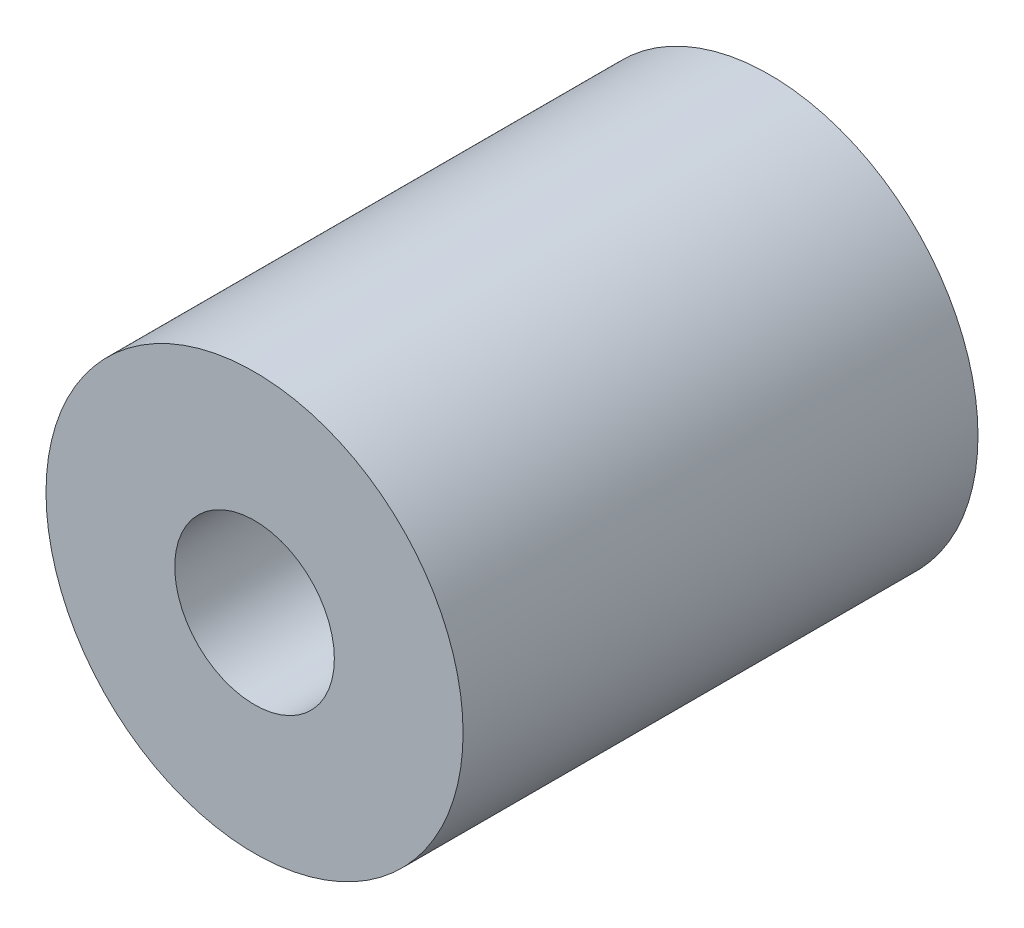
from build123d import *

# Parameters (mm, degrees)
SKETCH_1_R      = 4.05
SKETCH_1_R_2    = 1.55
EXTRUDE_1_DEPTH = 10


with BuildPart() as part:
    # 草图1 → 拉伸-薄壁1 (new body)
    with BuildSketch(Plane.XY):
        Circle(SKETCH_1_R)
        Circle(SKETCH_1_R_2, mode=Mode.SUBTRACT)
    extrude(amount=EXTRUDE_1_DEPTH)


solid = part.part
